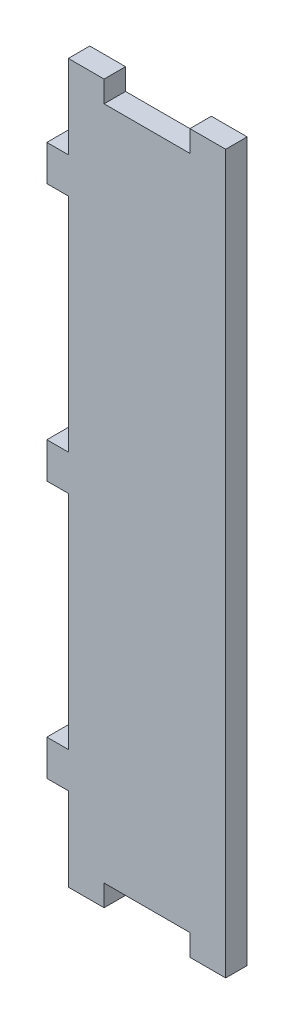
from build123d import *

# Parameters (mm, degrees)
ESQUISSE1_W             = 150
ESQUISSE1_H             = 602
BOSS_EXTRU_1_DEPTH      = 18
ESQUISSE2_W             = 18
ESQUISSE2_H             = 70
ESQUISSE2_H_2           = 186
ENL_V_MAT_EXTRU_1_DEPTH = 604.224667931
ESQUISSE3_W             = 72
ESQUISSE3_H             = 18
ENL_V_MAT_EXTRU_2_DEPTH = 604.224667931


with BuildPart() as part:
    # Esquisse1 → Boss.-Extru.1 (new body)
    with BuildSketch(Plane.XY):
        with Locations((75, 283)):
            Rectangle(ESQUISSE1_W, ESQUISSE1_H)
    extrude(amount=-BOSS_EXTRU_1_DEPTH)

    # Esquisse2 → Enlèv. mat.-Extru.1 (cut, through all)
    with BuildSketch(Plane.XY):
        with Locations((9, 549)):
            Rectangle(ESQUISSE2_W, ESQUISSE2_H)
        with Locations((9, 391)):
            Rectangle(ESQUISSE2_W, ESQUISSE2_H_2)
        with Locations((9, 175)):
            Rectangle(ESQUISSE2_W, ESQUISSE2_H_2)
        with Locations((9, 17)):
            Rectangle(ESQUISSE2_W, ESQUISSE2_H)
    extrude(amount=-ENL_V_MAT_EXTRU_1_DEPTH, mode=Mode.SUBTRACT)

    # Esquisse3 → Enlèv. mat.-Extru.2 (cut, through all)
    with BuildSketch(Plane.XY):
        with Locations((84, 575)):
            Rectangle(ESQUISSE3_W, ESQUISSE3_H)
        with Locations((84, -9)):
            Rectangle(ESQUISSE3_W, ESQUISSE3_H)
    extrude(amount=-ENL_V_MAT_EXTRU_2_DEPTH, mode=Mode.SUBTRACT)


solid = part.part
